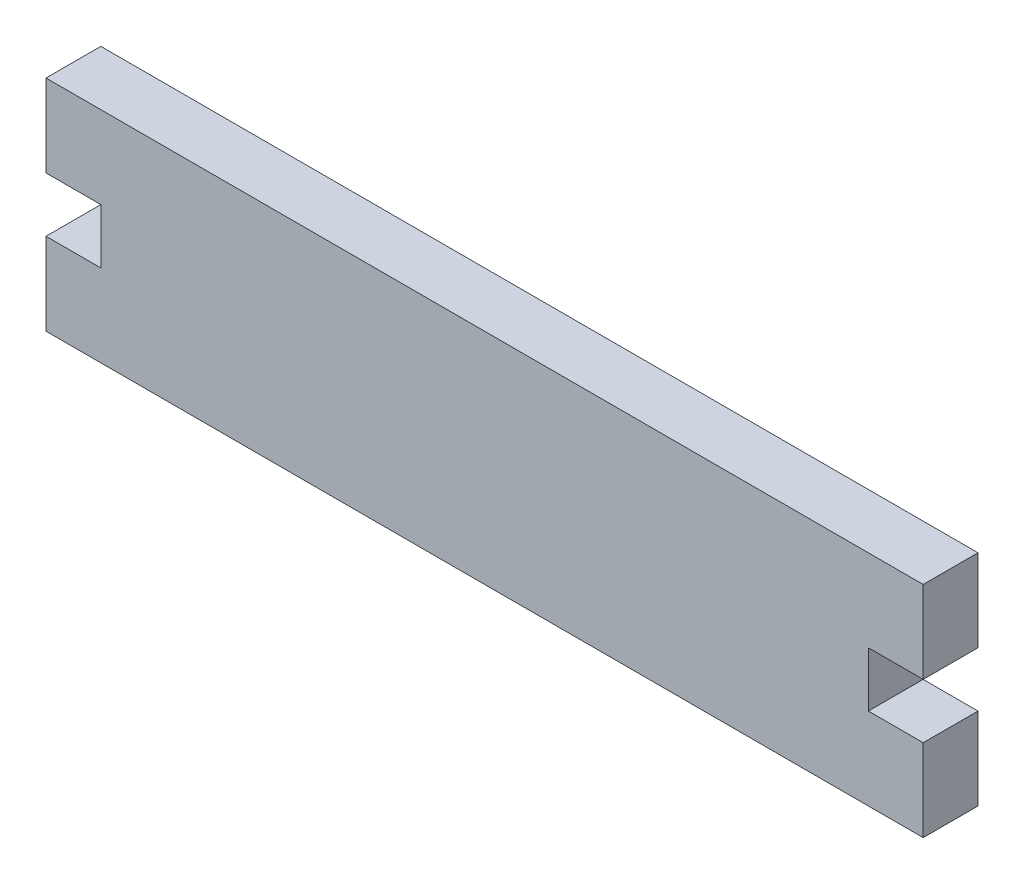
from build123d import *

# Parameters (mm, degrees)
BOSS_EXTRU_1_DEPTH = 5


with BuildPart() as part:
    # Esquisse1 → Boss.-Extru.1 (new body)
    with BuildSketch(Plane.XY):
        Polygon((0, 0), (70, 0), (75, 0), (75, 7.5), (70, 7.5), (70, 12.5), (75, 12.5), (75, 20), (70, 20), (0, 20), (-5, 20), (-5, 12.5), (0, 12.5), (0, 7.5), (-5, 7.5), (-5, 0), align=None)
    extrude(amount=BOSS_EXTRU_1_DEPTH)


solid = part.part
